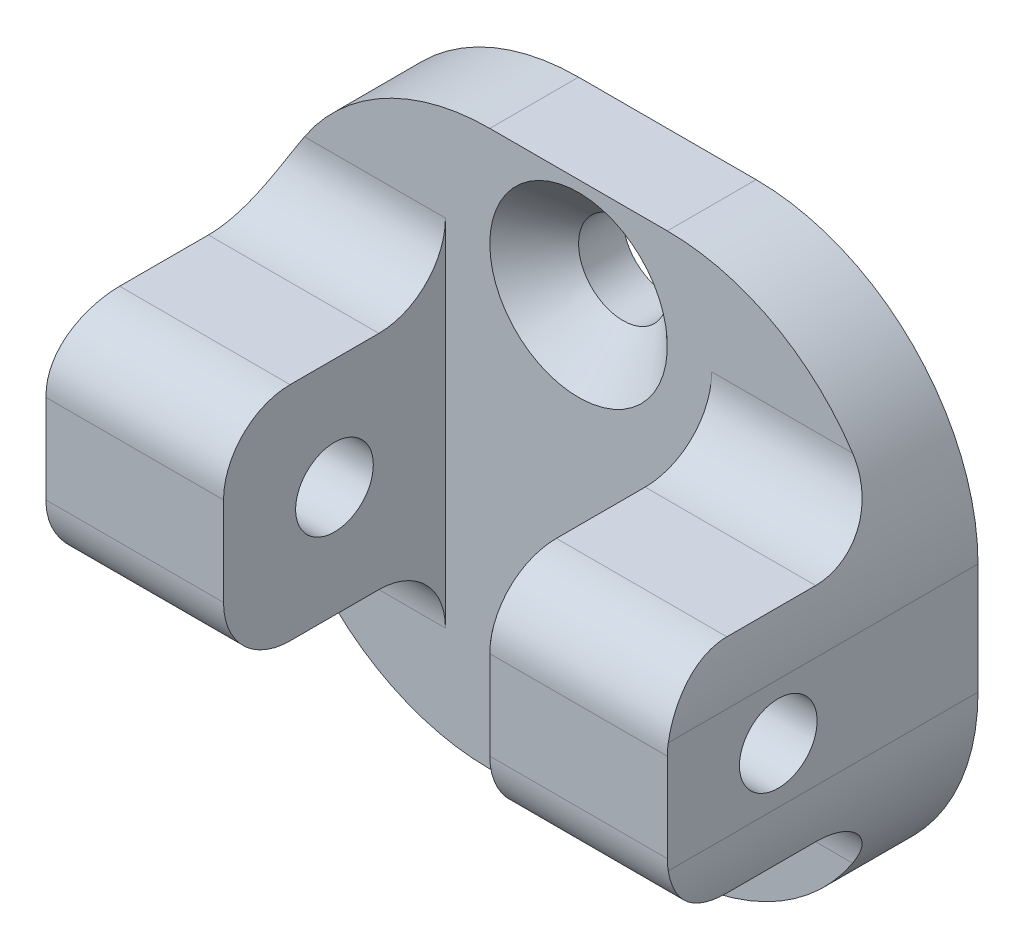
from build123d import *

# Parameters (mm, degrees)
ESQUISSE1_W                  = 28
ESQUISSE1_H                  = 25
BOSS_EXTRU_1_DEPTH           = 4
ESQUISSE2_W                  = 28
ESQUISSE2_H                  = 10
BOSS_EXTRU_2_DEPTH           = 10
ENL_V_MAT_EXTRU_1_DEPTH      = 41.062451248
ENL_V_MAT_EXTRU_1_DEPTH_BACK = 41.062451248
ESQUISSE3_R                  = 1.75
CONG_1_R                     = 3
ESQUISSE4_W                  = 12
ESQUISSE4_H                  = 16
ENL_V_MAT_EXTRU_2_DEPTH      = 10
ENL_V_MAT_EXTRU_3_DEPTH      = 39.845849199
ENL_V_MAT_EXTRU_3_DEPTH_BACK = 39.845849199
ESQUISSE5_R                  = 2
CHANFREIN1_SIZE              = 2
CONG_2_R                     = 10


with BuildPart() as part:
    # Esquisse1 → Boss.-Extru.1 (new body)
    with BuildSketch(Plane.XY):
        with Locations((14, 12.5)):
            Rectangle(ESQUISSE1_W, ESQUISSE1_H)
    extrude(amount=BOSS_EXTRU_1_DEPTH)

    # Esquisse2 → Boss.-Extru.2 (add)
    with BuildSketch(Plane.XY.offset(4)):
        with Locations((14, 12.5)):
            Rectangle(ESQUISSE2_W, ESQUISSE2_H)
    extrude(amount=BOSS_EXTRU_2_DEPTH)

    # Esquisse3 → Enlèv. mat.-Extru.1 (cut, two sides: drawn at the far end of the back side and taken through both)
    with BuildSketch(Plane(origin=(28, 0, 0), x_dir=(0, 0, -1), z_dir=(1, 0, 0)).offset(-ENL_V_MAT_EXTRU_1_DEPTH_BACK)):
        with Locations((-9, 12.5)):
            Circle(ESQUISSE3_R)
    extrude(amount=ENL_V_MAT_EXTRU_1_DEPTH + ENL_V_MAT_EXTRU_1_DEPTH_BACK, mode=Mode.SUBTRACT)

    # Congé1
    cong_1_edges = [part.edges().sort_by_distance(p)[0] for p in [
        (14, 17.5, 4),
        (14, 7.5, 4),
        (14, 17.5, 14),
        (14, 7.5, 14),
    ]]
    fillet(cong_1_edges, radius=CONG_1_R)

    # Esquisse4 → Enlèv. mat.-Extru.2 (cut)
    with BuildSketch(Plane.XY.offset(4)):
        with Locations((14, 12.5)):
            Rectangle(ESQUISSE4_W, ESQUISSE4_H)
    extrude(amount=ENL_V_MAT_EXTRU_2_DEPTH, mode=Mode.SUBTRACT)

    # Esquisse5 → Enlèv. mat.-Extru.3 (cut, two sides: drawn at the far end of the back side and taken through both)
    with BuildSketch(Plane.XY.offset(4).offset(-ENL_V_MAT_EXTRU_3_DEPTH_BACK)):
        with Locations((14, 20.5)):
            Circle(ESQUISSE5_R)
        with Locations(Location((14, 4.5, 0), (0, 0, 180))):
            Circle(ESQUISSE5_R)
    extrude(amount=ENL_V_MAT_EXTRU_3_DEPTH + ENL_V_MAT_EXTRU_3_DEPTH_BACK, mode=Mode.SUBTRACT)

    # Chanfrein1
    chanfrein1_edges = [part.edges().sort_by_distance(p)[0] for p in [
        (16, 4.5, 4),
        (12, 20.5, 4),
    ]]
    chamfer(chanfrein1_edges, length=CHANFREIN1_SIZE)

    # Congé2
    cong_2_edges = [part.edges().sort_by_distance(p)[0] for p in [
        (28, 0, 2),
        (0, 0, 2),
        (0, 25, 2),
        (28, 25, 2),
    ]]
    fillet(cong_2_edges, radius=CONG_2_R)


solid = part.part
